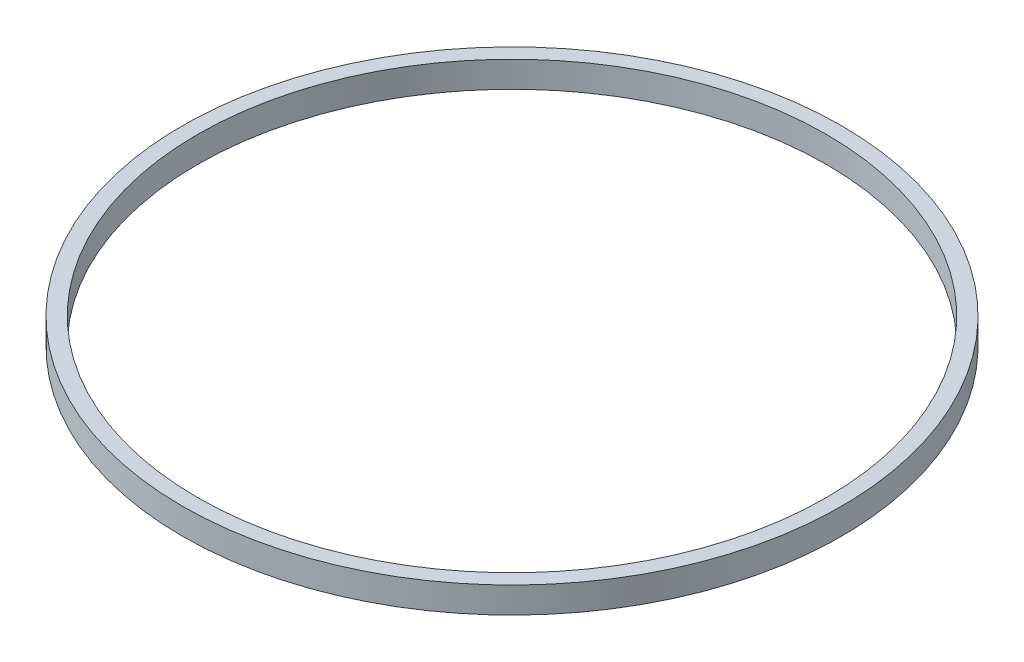
from build123d import *

# Parameters (mm, degrees)
SKETCH1_R           = 240.5
SKETCH1_R_2         = 229.5
BOSS_EXTRUDE1_DEPTH = 9.5


with BuildPart() as part:
    # Sketch1 → Boss-Extrude1 (new, symmetric)
    with BuildSketch(Plane(origin=(0, 0, 0), x_dir=(1, 0, 0), z_dir=(0, 1, 0))):
        with Locations(Location((0, 0, 0), (0, 0, 270))):
            Circle(SKETCH1_R)
        with Locations(Location((0, 0, 0), (0, 0, 270))):
            Circle(SKETCH1_R_2, mode=Mode.SUBTRACT)
    extrude(amount=BOSS_EXTRUDE1_DEPTH, both=True)


solid = part.part
